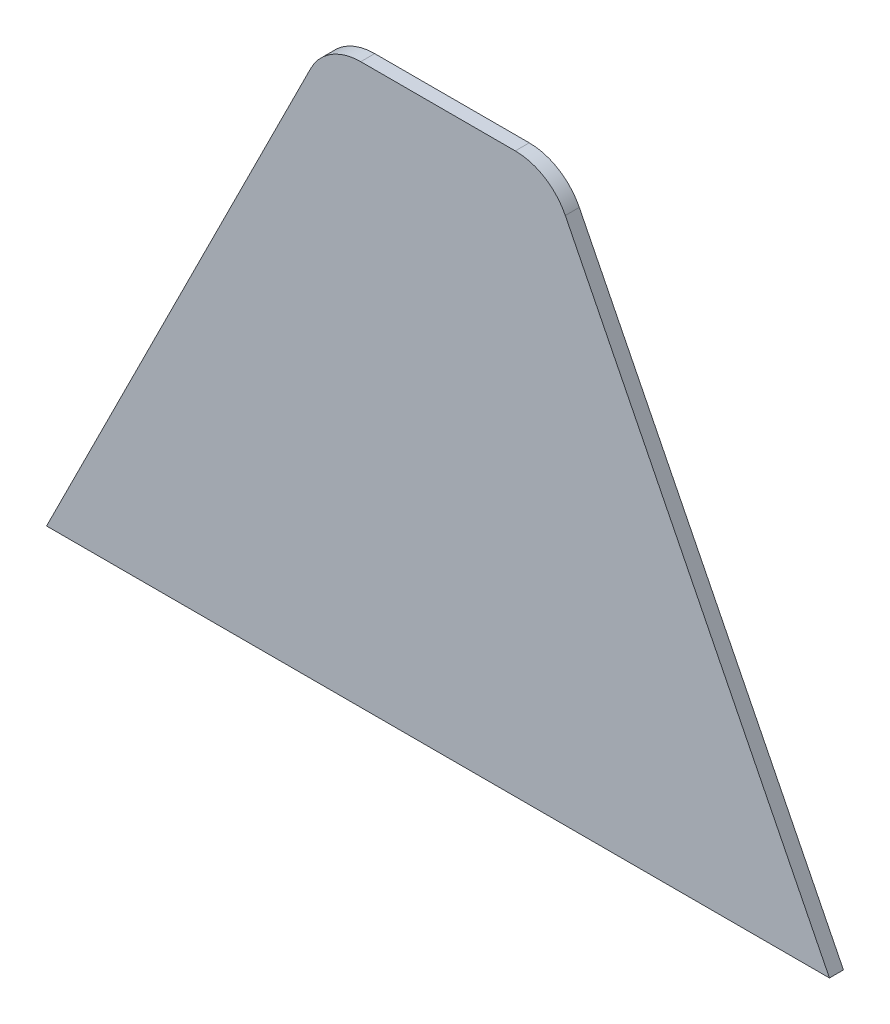
from build123d import *

# Parameters (mm, degrees)
MAINSHAPE_DEPTH = 3.175
FILLET1_R       = 12.7


with BuildPart() as part:
    # Sketch1 → MainShape (new body)
    with BuildSketch(Plane.XY):
        Polygon((0, 0), (63.5, 127), (114.3, 127), (177.8, 0), align=None)
    extrude(amount=MAINSHAPE_DEPTH)

    # Fillet1
    fillet1_edges = [part.edges().sort_by_distance(p)[0] for p in [
        (63.5, 127, 1.5875),
        (114.3, 127, 1.5875),
    ]]
    fillet(fillet1_edges, radius=FILLET1_R)


solid = part.part
